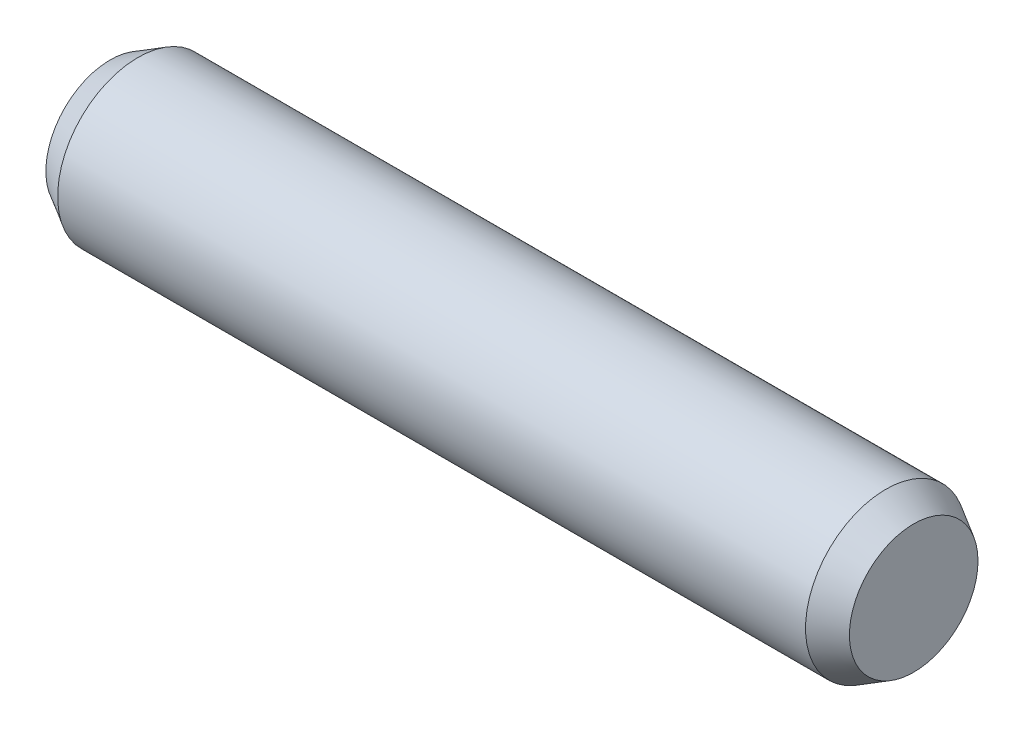
from build123d import *

# Parameters (mm, degrees)
SKETCH4_R           = 5
BOSS_EXTRUDE2_DEPTH = 50
CHAMFER1_SIZE       = 1
CHAMFER1_SIZE2      = 1.732050808
CHAMFER2_SIZE       = 1
CHAMFER2_SIZE2      = 1.732050808


with BuildPart() as part:
    # Sketch4 → Boss-Extrude2 (new body)
    with BuildSketch(Plane(origin=(0, 0, 0), x_dir=(0, 0, -1), z_dir=(1, 0, 0))):
        Circle(SKETCH4_R)
    extrude(amount=BOSS_EXTRUDE2_DEPTH)

    # Chamfer1
    chamfer1_edges = [part.edges().sort_by_distance(p)[0] for p in [
        (0, 0, 5),
    ]]
    chamfer1_side = [part.faces().sort_by_distance(p)[0] for p in [
        (0, 0, 0),
    ]]
    chamfer(chamfer1_edges, length=CHAMFER1_SIZE, length2=CHAMFER1_SIZE2, reference=chamfer1_side[0])

    # Chamfer2
    chamfer2_edges = [part.edges().sort_by_distance(p)[0] for p in [
        (50, 0, 5),
    ]]
    chamfer2_side = [part.faces().sort_by_distance(p)[0] for p in [
        (50, 0, 0),
    ]]
    chamfer(chamfer2_edges, length=CHAMFER2_SIZE, length2=CHAMFER2_SIZE2, reference=chamfer2_side[0])


solid = part.part
